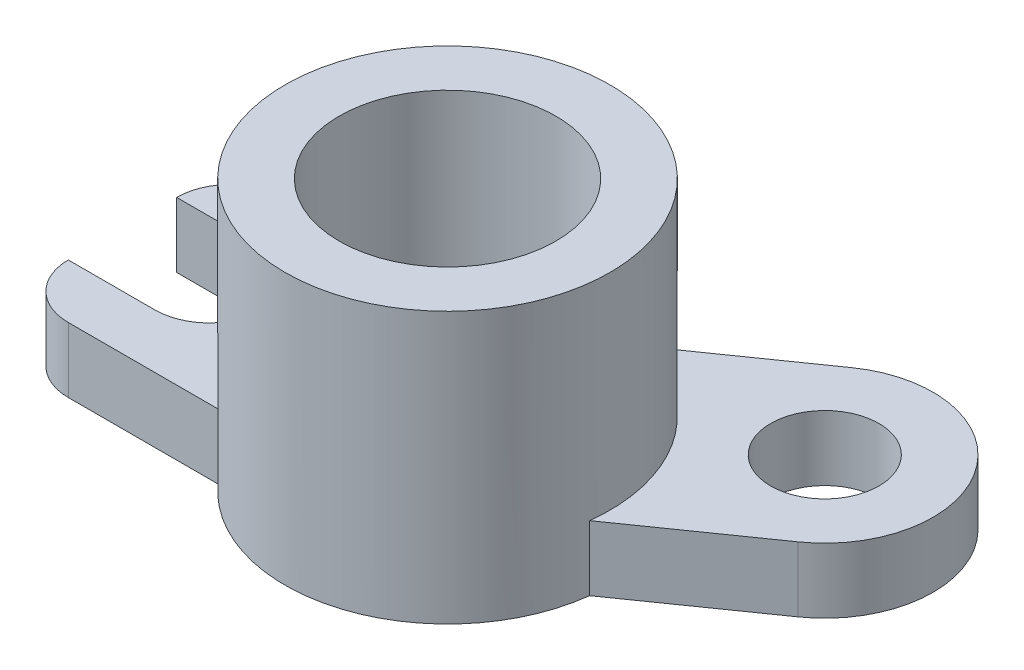
from build123d import *

# Parameters (mm, degrees)
SKETCH_1_R      = 15
SKETCH_1_R_2    = 10
EXTRUDE_1_DEPTH = 25
SKETCH_2_R      = 5
EXTRUDE_2_DEPTH = 6


with BuildPart() as part:
    # 草圖1 → 伸長1 (new body)
    with BuildSketch(Plane(origin=(0, 0, 0), x_dir=(1, 0, 0), z_dir=(0, 1, 0))):
        with Locations(Location((0, 0, 0), (0, 0, 270))):
            Circle(SKETCH_1_R)
        with Locations(Location((0, 0, 0), (0, 0, 270))):
            Circle(SKETCH_1_R_2, mode=Mode.SUBTRACT)
    extrude(amount=EXTRUDE_1_DEPTH)

    # 草圖2 → 伸長2 (add)
    # profile 1 of 2: a face of its own
    with BuildSketch(Plane(origin=(0, 0, 0), x_dir=(1, 0, 0), z_dir=(0, 1, 0))):
        with BuildLine():
            ThreePointArc((-11.180339887, -10), (-15, 0), (-11.180339887, 10))
            Line((-11.180339887, 10), (-25, 10))
            ThreePointArc((-25, 10), (-28.535533906, 8.535533906), (-30, 5))
            Line((-30, 5), (-22, 5))
            ThreePointArc((-22, 5), (-17, 0), (-22, -5))
            Line((-22, -5), (-30, -5))
            ThreePointArc((-30, -5), (-28.535533906, -8.535533906), (-25, -10))
            Line((-25, -10), (-11.180339887, -10))
        make_face()
    # profile 2 of 2: a face of its own
    with BuildSketch(Plane(origin=(0, 0, 0), x_dir=(1, 0, 0), z_dir=(0, 1, 0))):
        with BuildLine():
            Line((14.743036744, 22.530931352), (3.422633911, 14.604299953))
            ThreePointArc((3.422633911, 14.604299953), (11.754563128, 9.318274822), (15, 0))
            ThreePointArc((15, 0), (14.973517282, -0.89094344), (14.894162638, -1.778740933))
            Line((14.894162638, -1.778740933), (26.214565471, 6.147890466))
            ThreePointArc((26.214565471, 6.147890466), (28.67032155, 20.075175272), (14.743036744, 22.530931352))
        make_face()
        with Locations(Location((20.478801107, 14.339410909, 0), (0, 0, 270))):
            Circle(SKETCH_2_R, mode=Mode.SUBTRACT)
    extrude(amount=EXTRUDE_2_DEPTH)


solid = part.part
